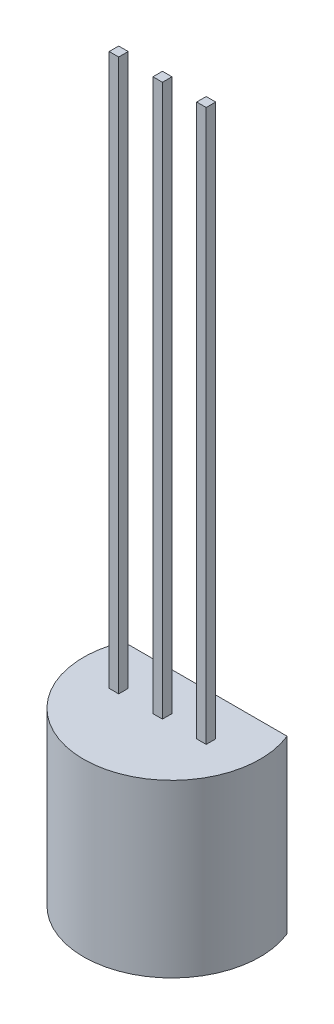
from build123d import *

# Parameters (mm, degrees)
BOSS_EXTRUDE1_DEPTH = 4.5
SKETCH2_W           = 0.25
SKETCH2_H           = 0.25
BOSS_EXTRUDE2_DEPTH = 14.5


with BuildPart() as part:
    # Sketch1 → Boss-Extrude1 (new body)
    with BuildSketch(Plane(origin=(0, 0, 0), x_dir=(1, 0, 0), z_dir=(0, 1, 0))):
        with BuildLine():
            Line((0, 0), (4.3, 0))
            ThreePointArc((4.3, 0), (2.15, -3.2), (0, 0))
        make_face()
    extrude(amount=BOSS_EXTRUDE1_DEPTH)

    # Sketch2 → Boss-Extrude2 (add)
    with BuildSketch(Plane(origin=(0, 4.5, 0), x_dir=(1, 0, 0), z_dir=(0, 1, 0))):
        with Locations((3.3, -1.125)):
            Rectangle(SKETCH2_W, SKETCH2_H)
        with Locations((2.15, -1.125)):
            Rectangle(SKETCH2_W, SKETCH2_H)
        with Locations((1, -1.125)):
            Rectangle(SKETCH2_W, SKETCH2_H)
    extrude(amount=BOSS_EXTRUDE2_DEPTH)


solid = part.part
